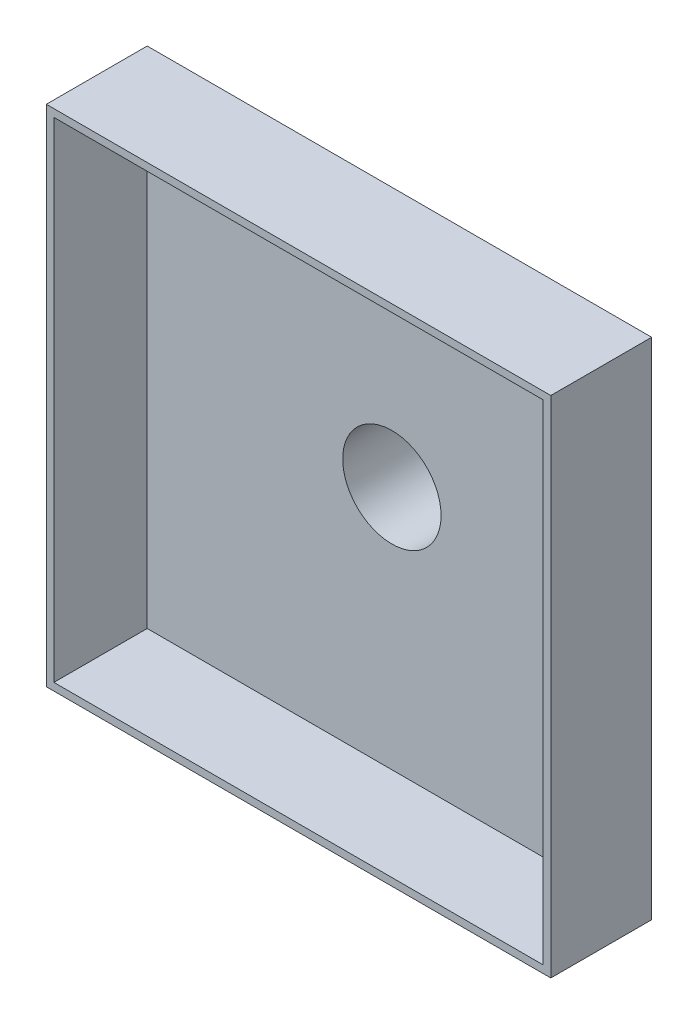
from build123d import *

# Parameters (mm, degrees)
SKETCH_1_W      = 200
SKETCH_1_H      = 200
EXTRUDE_1_DEPTH = 40
SKETCH_2_R      = 22.5
EXTRUDE_2_DEPTH = 40
SHELL_1_T       = -3


with BuildPart() as part:
    # ｽｹｯﾁ1 → ﾎﾞｽ - 押し出し1 (new body)
    with BuildSketch(Plane.XY):
        Rectangle(SKETCH_1_W, SKETCH_1_H)
    extrude(amount=EXTRUDE_1_DEPTH)

    # ｽｹｯﾁ2 → ﾎﾞｽ - 押し出し2 (add)
    with BuildSketch(Plane.XY):
        Circle(SKETCH_2_R)
    extrude(amount=-EXTRUDE_2_DEPTH)

    # ｼｪﾙ1
    shell_1_openings = [part.faces().sort_by_distance(p)[0] for p in [
        (0, 0, 40),
    ]]
    offset(amount=SHELL_1_T, openings=shell_1_openings, kind=Kind.INTERSECTION)


solid = part.part
